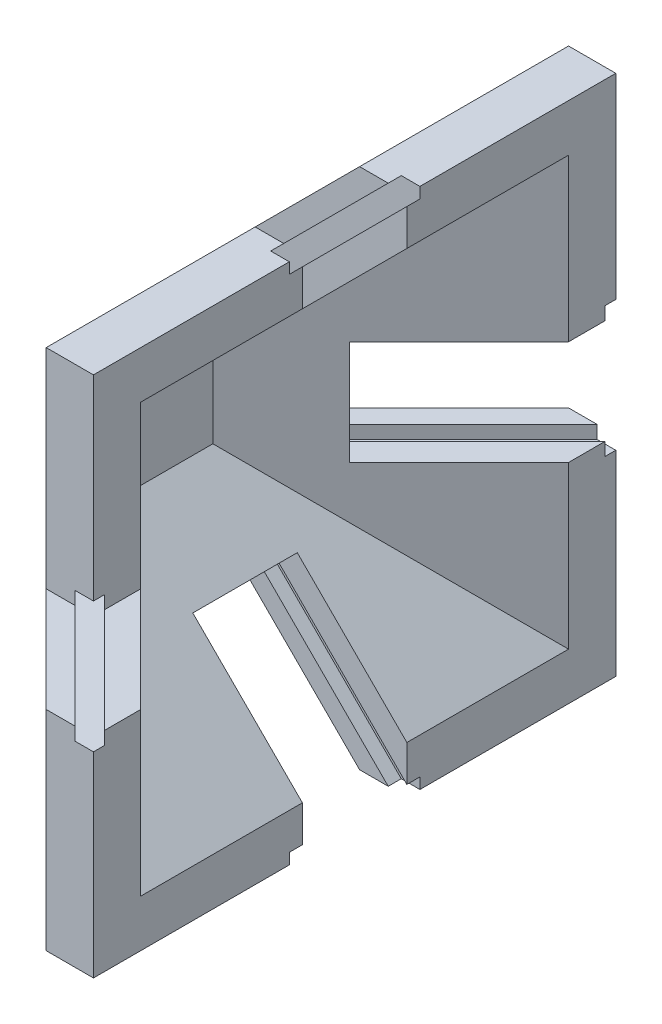
from build123d import *

# Parameters (mm, degrees)
SKETCH3_W           = 50.8
SKETCH3_H           = 50.8
BOSS_EXTRUDE1_DEPTH = 29.996194
CUT_EXTRUDE1_DEPTH  = 65.230613146
CIRPATTERN1_COUNT   = 4
SKETCH8_W           = 12.7
SKETCH8_H           = 12.7
CUT_EXTRUDE2_DEPTH  = 44.00537756
CUT_EXTRUDE3_START  = -20.21
CUT_EXTRUDE3_DEPTH  = 84.434853552
SKETCH10_W          = 2.032
SKETCH10_H          = 12.7
CUT_EXTRUDE4_DEPTH  = 21.76
CIRPATTERN2_COUNT   = 4
SKETCH11_W          = 6.35
SKETCH11_H          = 6.35
CUT_EXTRUDE5_DEPTH  = 41.659838908


with BuildPart() as part:
    # Sketch3 → Boss-Extrude1 (new body)
    with BuildSketch(Plane(origin=(0, 0, 0), x_dir=(0, 0, -1), z_dir=(1, 0, 0))):
        Rectangle(SKETCH3_W, SKETCH3_H)
    extrude(amount=BOSS_EXTRUDE1_DEPTH)

    # Sketch4 → Cut-Loft1 section 0
    with BuildSketch(Plane(origin=(12.7, 0, 0), x_dir=(0, 0, -1), z_dir=(1, 0, 0))):
        with BuildLine():
            Line((-3.507611845, 3.507611845), (3.507611845, 3.507611845))
            Line((3.507611845, 3.507611845), (3.507611845, -3.507611845))
            Line((3.507611845, -3.507611845), (-3.507611845, -3.507611845))
            Line((-3.507611845, -3.507611845), (-3.507611845, 3.507611845))
        make_face()
    # Sketch5 → Cut-Loft1 section 1
    with BuildSketch(Plane(origin=(29.996194078, 0, 0), x_dir=(0, 0, -1), z_dir=(1, 0, 0))):
        with BuildLine():
            Line((-20.803805922, 20.803805922), (20.803805922, 20.803805922))
            Line((20.803805922, 20.803805922), (20.803805922, -20.803805922))
            Line((20.803805922, -20.803805922), (-20.803805922, -20.803805922))
            Line((-20.803805922, -20.803805922), (-20.803805922, 20.803805922))
        make_face()
    loft(mode=Mode.SUBTRACT)

    # Sketch6 → Cut-Extrude1 (cut, through all)
    with BuildSketch(Plane(origin=(0, 25.4, 0), x_dir=(1, 0, 0), z_dir=(0, 1, 0))):
        Polygon((25.4, -25.4), (0, 0), (0, -25.4), align=None)
    cut_extrude1 = extrude(amount=-CUT_EXTRUDE1_DEPTH, mode=Mode.SUBTRACT)

    # CirPattern1: Cut-Extrude1 ×4 about axis
    cirpattern1_axis = Axis((0, 0, 0), (1, 0, 0))
    for i in range(1, CIRPATTERN1_COUNT):
        add(cut_extrude1.rotate(cirpattern1_axis, i * 360 / CIRPATTERN1_COUNT), mode=Mode.SUBTRACT)

    # Sketch8 → Cut-Extrude2 (cut, through all)
    with BuildSketch(Plane(origin=(6.35, 0, 0), x_dir=(0, 0, -1), z_dir=(1, 0, 0))):
        Rectangle(SKETCH8_W, SKETCH8_H)
    extrude(amount=-CUT_EXTRUDE2_DEPTH, mode=Mode.SUBTRACT)

    # Sketch9 → Cut-Extrude3 (cut)
    with BuildSketch(Plane(origin=(31.142405514, 0, 26.921685137), x_dir=(0.7071067811865474, 0, -0.7071067811865477), z_dir=(0.7071067811865477, 0, 0.7071067811865474)).offset(CUT_EXTRUDE3_START)):
        Polygon((-1.016, 5.08), (-1.016, 6.35), (1.016, 6.35), (1.016, 5.08), (3.5155, 5.08), (3.5155, -5.08), (1.016, -5.08), (1.016, -6.35), (-1.016, -6.35), (-1.016, -5.08), (-3.5155, -5.08), (-3.5155, 5.08), align=None)
    cut_extrude3 = extrude(amount=CUT_EXTRUDE3_DEPTH, mode=Mode.SUBTRACT)

    # Sketch10 → Cut-Extrude4 (cut)
    with BuildSketch(Plane(origin=(31.142405514, 0, 26.921685137), x_dir=(0.7071067811865474, 0, -0.7071067811865477), z_dir=(0.7071067811865477, 0, 0.7071067811865474))):
        Rectangle(SKETCH10_W, SKETCH10_H)
    cut_extrude4 = extrude(amount=-CUT_EXTRUDE4_DEPTH, mode=Mode.SUBTRACT)

    # CirPattern2: Cut-Extrude3, Cut-Extrude4 ×4 about axis
    cirpattern2_axis = Axis((0, 0, 0), (1, 0, 0))
    add([cut_extrude3.rotate(cirpattern2_axis, i * 360 / CIRPATTERN2_COUNT) for i in range(1, CIRPATTERN2_COUNT)], mode=Mode.SUBTRACT)
    add([cut_extrude4.rotate(cirpattern2_axis, i * 360 / CIRPATTERN2_COUNT) for i in range(1, CIRPATTERN2_COUNT)], mode=Mode.SUBTRACT)

    # Sketch11 → Cut-Extrude5 (cut, through all)
    with BuildSketch(Plane(origin=(25.4, 0, 0), x_dir=(0, 0, -1), z_dir=(1, 0, 0))):
        with Locations((22.225, 22.225)):
            Rectangle(SKETCH11_W, SKETCH11_H)
        with Locations((22.225, -22.225)):
            Rectangle(SKETCH11_W, SKETCH11_H)
        with Locations((-22.225, -22.225)):
            Rectangle(SKETCH11_W, SKETCH11_H)
        with Locations((-22.225, 22.225)):
            Rectangle(SKETCH11_W, SKETCH11_H)
    extrude(amount=-CUT_EXTRUDE5_DEPTH, mode=Mode.SUBTRACT)


solid = part.part
